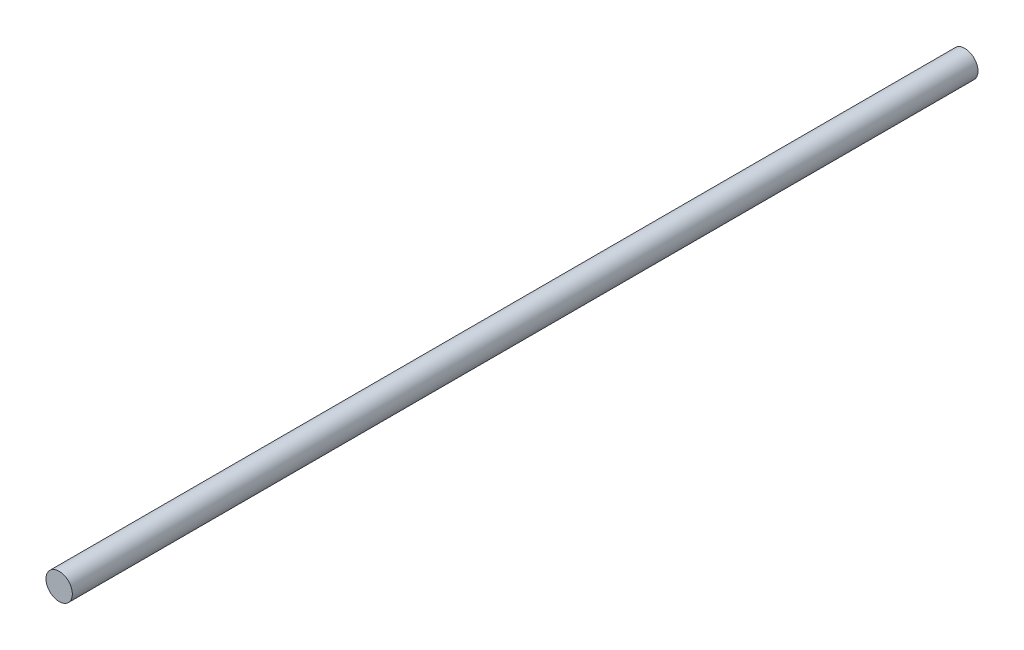
from build123d import *

# Parameters (mm, degrees)
CROQUIS1_R              = 8
SALIENTE_EXTRUIR1_DEPTH = 550


with BuildPart() as part:
    # Croquis1 → Saliente-Extruir1 (new body)
    with BuildSketch(Plane.XY):
        Circle(CROQUIS1_R)
    extrude(amount=SALIENTE_EXTRUIR1_DEPTH)


solid = part.part
